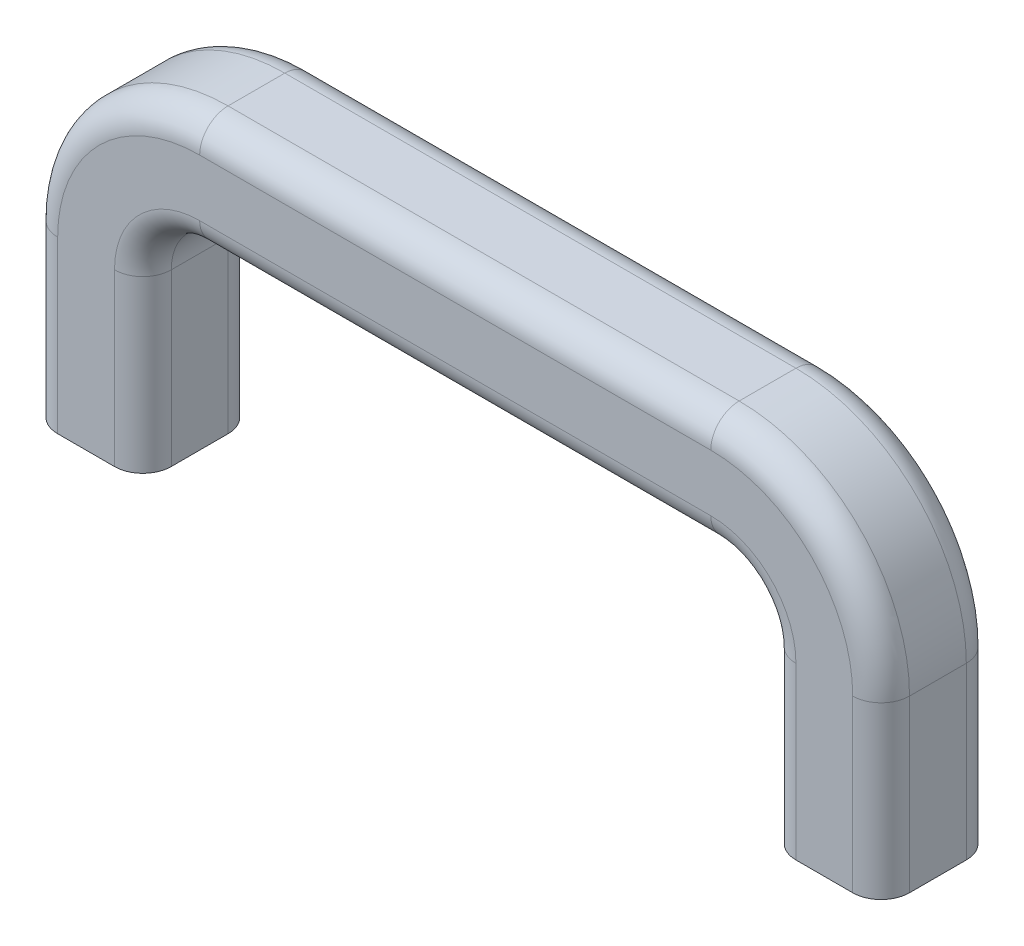
from build123d import *

# Parameters (mm, degrees)
SKICA1_W                 = 150
SKICA1_H                 = 20
P_IDAT_VYSUNUT_M1_DEPTH  = 60
SKICA2_W                 = 110
SKICA2_H                 = 40
ODEBRAT_VYSUNUT_M1_DEPTH = 60
ZAOBLIT1_R               = 10
ZAOBLIT2_R               = 30
ZAOBLIT3_R               = 5


with BuildPart() as part:
    # Skica1 → Přidat vysunutím1 (new body)
    with BuildSketch(Plane(origin=(0, 0, 0), x_dir=(1, 0, 0), z_dir=(0, 1, 0))):
        Rectangle(SKICA1_W, SKICA1_H)
    extrude(amount=P_IDAT_VYSUNUT_M1_DEPTH)

    # Skica2 → Odebrat vysunutím1 (cut)
    with BuildSketch(Plane.XY.offset(10)):
        with Locations((0, 20)):
            Rectangle(SKICA2_W, SKICA2_H)
    extrude(amount=-ODEBRAT_VYSUNUT_M1_DEPTH, mode=Mode.SUBTRACT)

    # Zaoblit1
    zaoblit1_edges = [part.edges().sort_by_distance(p)[0] for p in [
        (-55, 40, 0),
        (55, 40, 0),
    ]]
    fillet(zaoblit1_edges, radius=ZAOBLIT1_R)

    # Zaoblit2
    zaoblit2_edges = [part.edges().sort_by_distance(p)[0] for p in [
        (75, 60, 0),
        (-75, 60, 0),
    ]]
    fillet(zaoblit2_edges, radius=ZAOBLIT2_R)

    # Zaoblit3
    zaoblit3_edges = [part.edges().sort_by_distance(p)[0] for p in [
        (55, 15, -10),
        (55, 15, 10),
        (0, 40, 10),
        (0, 40, -10),
        (-55, 15, 10),
        (-55, 15, -10),
        (52.071067812, 37.071067812, 10),
        (52.071067812, 37.071067812, -10),
        (-52.071067812, 37.071067812, 10),
        (-52.071067812, 37.071067812, -10),
        (0, 60, 10),
        (0, 60, -10),
        (-75, 15, -10),
        (75, 15, -10),
        (-66.213203436, 51.213203436, -10),
        (66.213203436, 51.213203436, -10),
        (75, 15, 10),
        (-75, 15, 10),
        (-66.213203436, 51.213203436, 10),
        (66.213203436, 51.213203436, 10),
    ]]
    fillet(zaoblit3_edges, radius=ZAOBLIT3_R)


solid = part.part
